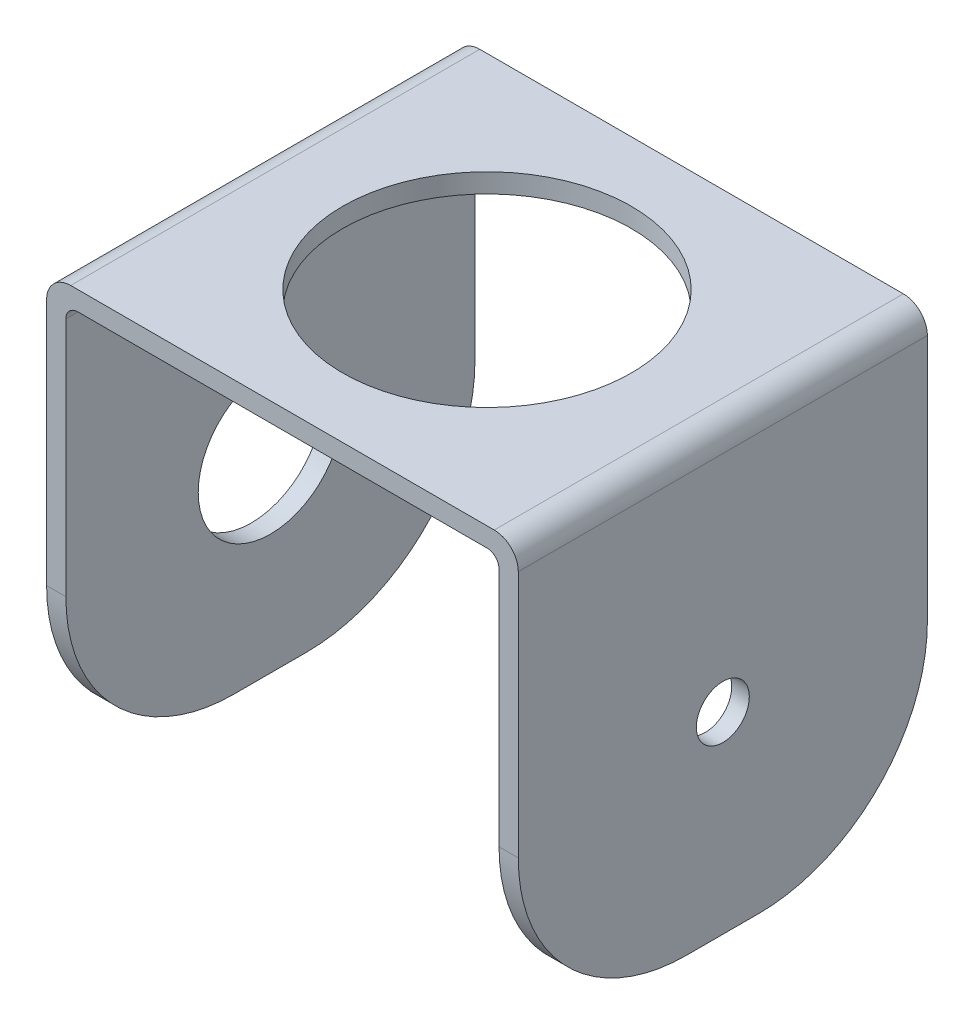
from build123d import *

# Parameters (mm, degrees)
EXTRUDE_1_DEPTH          = 170
SKETCH_2_R               = 60
CUT_EXTRUDE_1_DEPTH      = 180
CUT_EXTRUDE_2_DEPTH      = 313.955268369
CUT_EXTRUDE_2_DEPTH_BACK = 313.955268369
SKETCH_3_R               = 11
FILLET_1_R               = 70
FILLET_2_R               = 5
FILLET_3_R               = 10
SKETCH_6_R               = 30
CUT_EXTRUDE_6_DEPTH      = 39
SKETCH_7_R               = 13
CUT_EXTRUDE_7_DEPTH      = 0.7


with BuildPart() as part:
    # 草图1 → 凸台-拉伸1 (new body)
    with BuildSketch(Plane.XY):
        Polygon((-180, 0), (0, 0), (0, -175), (8, -175), (8, 8), (-180, 8), (-188, 8), (-188, -175), (-180, -175), align=None)
    extrude(amount=EXTRUDE_1_DEPTH)

    # 草图2 → 切除-拉伸1 (cut)
    with BuildSketch(Plane(origin=(0, 8, 0), x_dir=(1, 0, 0), z_dir=(0, 1, 0))):
        with Locations(Location((-90, -85, 0), (0, 0, 180))):
            Circle(SKETCH_2_R)
    extrude(amount=-CUT_EXTRUDE_1_DEPTH, mode=Mode.SUBTRACT)

    # 草图3 → 切除-拉伸2 (cut, two sides: drawn at the far end of the back side and taken through both)
    with BuildSketch(Plane(origin=(8, 0, 0), x_dir=(0, 0, -1), z_dir=(1, 0, 0)).offset(-CUT_EXTRUDE_2_DEPTH_BACK)):
        with Locations(Location((-85, -95, 0), (0, 0, 90))):
            Circle(SKETCH_3_R)
    extrude(amount=CUT_EXTRUDE_2_DEPTH + CUT_EXTRUDE_2_DEPTH_BACK, mode=Mode.SUBTRACT)

    # 圆角1
    fillet_1_edges = [part.edges().sort_by_distance(p)[0] for p in [
        (4, -175, 0),
        (4, -175, 170),
        (-184, -175, 170),
        (-184, -175, 0),
    ]]
    fillet(fillet_1_edges, radius=FILLET_1_R)

    # 圆角2
    fillet_2_edges = [part.edges().sort_by_distance(p)[0] for p in [
        (0, 0, 85),
        (-180, 0, 85),
    ]]
    fillet(fillet_2_edges, radius=FILLET_2_R)

    # 圆角3
    fillet_3_edges = [part.edges().sort_by_distance(p)[0] for p in [
        (-188, 8, 85),
        (8, 8, 85),
    ]]
    fillet(fillet_3_edges, radius=FILLET_3_R)

    # 草图6 → 切除-拉伸6 (cut)
    with BuildSketch(Plane.ZY.offset(188)):
        with Locations(Location((85, -95, 0), (0, 0, 270))):
            Circle(SKETCH_6_R)
    extrude(amount=-CUT_EXTRUDE_6_DEPTH, mode=Mode.SUBTRACT)

    # 草图7 → 切除-拉伸7 (cut)
    with BuildSketch(Plane.ZY):
        with Locations(Location((85, -95, 0), (0, 0, 270))):
            Circle(SKETCH_7_R)
    extrude(amount=-CUT_EXTRUDE_7_DEPTH, mode=Mode.SUBTRACT)


solid = part.part
